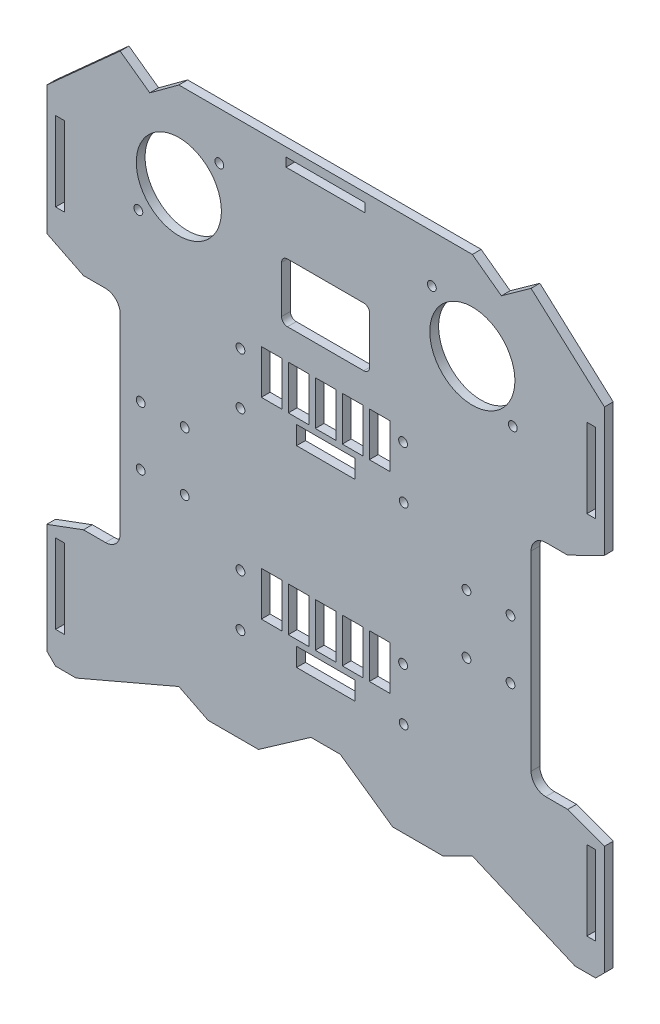
from build123d import *

# Parameters (mm, degrees)
MODEL_R             = 1.5
MODEL_R_2           = 14.5
MODEL_W             = 3
MODEL_H             = 27
MODEL_W_2           = 27
MODEL_H_2           = 3
MODEL_W_3           = 7
MODEL_H_3           = 15
MODEL_W_4           = 19.975
MODEL_H_4           = 6.25
BOSS_EXTRUDE1_DEPTH = 3


with BuildPart() as part:
    # Model → Boss-Extrude1 (new body)
    with BuildSketch(Plane.XY):
        with BuildLine():
            Line((190, 103.697579254), (190, 147.5))
            Line((190, 147.5), (165, 170))
            Line((165, 170), (154.89207995, 162.725031973))
            Line((154.89207995, 162.725031973), (145, 170))
            Line((145, 170), (45, 170))
            Line((45, 170), (35.10792005, 162.725031973))
            Line((35.10792005, 162.725031973), (25, 170))
            Line((25, 170), (0, 147.5))
            Line((0, 147.5), (0, 103.697579254))
            Line((0, 103.697579254), (12.5, 97.5))
            Line((12.5, 97.5), (20, 97.5))
            ThreePointArc((20, 97.5), (23.535533906, 96.035533906), (25, 92.5))
            Line((25, 92.5), (25, 27.5))
            ThreePointArc((25, 27.5), (23.535533906, 23.964466094), (20, 22.5))
            Line((20, 22.5), (12.5, 22.5))
            Line((12.5, 22.5), (0, 17.867533831))
            Line((0, 17.867533831), (0, 0))
            Line((0, 0), (0, -19.5))
            Line((0, -19.5), (3, -22.5))
            Line((3, -22.5), (10, -22.5))
            Line((10, -22.5), (45, -7.5))
            Line((45, -7.5), (55, -12.5))
            Line((55, -12.5), (72.142857143, -12.5))
            Line((72.142857143, -12.5), (90, 0))
            Line((90, 0), (100, 0))
            Line((100, 0), (117.857142857, -12.5))
            Line((117.857142857, -12.5), (135, -12.5))
            Line((135, -12.5), (145, -7.5))
            Line((145, -7.5), (180, -22.5))
            Line((180, -22.5), (187, -22.5))
            Line((187, -22.5), (190, -19.5))
            Line((190, -19.5), (190, 0))
            Line((190, 0), (190, 17.867533831))
            Line((190, 17.867533831), (177.5, 22.5))
            Line((177.5, 22.5), (170, 22.5))
            ThreePointArc((170, 22.5), (166.464466094, 23.964466094), (165, 27.5))
            Line((165, 27.5), (165, 92.5))
            ThreePointArc((165, 92.5), (166.464466094, 96.035533906), (170, 97.5))
            Line((170, 97.5), (177.5, 97.5))
            Line((177.5, 97.5), (190, 103.697579254))
        make_face()
        with Locations((32, 50)):
            Circle(MODEL_R, mode=Mode.SUBTRACT)
        with Locations((47, 50)):
            Circle(MODEL_R, mode=Mode.SUBTRACT)
        with Locations((32, 70)):
            Circle(MODEL_R, mode=Mode.SUBTRACT)
        with Locations((47, 70)):
            Circle(MODEL_R, mode=Mode.SUBTRACT)
        with Locations((158, 70)):
            Circle(MODEL_R, mode=Mode.SUBTRACT)
        with Locations((143, 70)):
            Circle(MODEL_R, mode=Mode.SUBTRACT)
        with Locations((158, 50)):
            Circle(MODEL_R, mode=Mode.SUBTRACT)
        with Locations((143, 50)):
            Circle(MODEL_R, mode=Mode.SUBTRACT)
        with Locations((45, 140)):
            Circle(MODEL_R_2, mode=Mode.SUBTRACT)
        with Locations((31.211417767, 126.211417767)):
            Circle(MODEL_R, mode=Mode.SUBTRACT)
        with Locations((58.788582233, 153.788582233)):
            Circle(MODEL_R, mode=Mode.SUBTRACT)
        with Locations((145, 140)):
            Circle(MODEL_R_2, mode=Mode.SUBTRACT)
        with Locations((158.788582233, 126.211417767)):
            Circle(MODEL_R, mode=Mode.SUBTRACT)
        with Locations((131.211417767, 153.788582233)):
            Circle(MODEL_R, mode=Mode.SUBTRACT)
        with Locations((65.995999264, 37.286813453)):
            Circle(MODEL_R, mode=Mode.SUBTRACT)
        with Locations((65.995999264, 19.661813453)):
            Circle(MODEL_R, mode=Mode.SUBTRACT)
        with Locations((121.395999264, 37.386813453)):
            Circle(MODEL_R, mode=Mode.SUBTRACT)
        with Locations((121.595999264, 19.661813453)):
            Circle(MODEL_R, mode=Mode.SUBTRACT)
        with Locations((65.995999264, 85.107027522)):
            Circle(MODEL_R, mode=Mode.SUBTRACT)
        with Locations((65.995999264, 102.732027522)):
            Circle(MODEL_R, mode=Mode.SUBTRACT)
        with Locations((121.395999264, 102.832027522)):
            Circle(MODEL_R, mode=Mode.SUBTRACT)
        with Locations((121.595999264, 85.107027522)):
            Circle(MODEL_R, mode=Mode.SUBTRACT)
        with Locations((4.5, 126.5)):
            Rectangle(MODEL_W, MODEL_H, mode=Mode.SUBTRACT)
        with Locations((185.5, 126.5)):
            Rectangle(MODEL_W, MODEL_H, mode=Mode.SUBTRACT)
        with Locations((95, 165.5)):
            Rectangle(MODEL_W_2, MODEL_H_2, mode=Mode.SUBTRACT)
        with Locations((76.6, 99.390878679)):
            Rectangle(MODEL_W_3, MODEL_H_3, mode=Mode.SUBTRACT)
        with Locations((85.8, 99.390878679)):
            Rectangle(MODEL_W_3, MODEL_H_3, mode=Mode.SUBTRACT)
        with Locations((95, 99.390878679)):
            Rectangle(MODEL_W_3, MODEL_H_3, mode=Mode.SUBTRACT)
        with Locations((104.2, 99.390878679)):
            Rectangle(MODEL_W_3, MODEL_H_3, mode=Mode.SUBTRACT)
        with Locations((113.4, 99.390878679)):
            Rectangle(MODEL_W_3, MODEL_H_3, mode=Mode.SUBTRACT)
        with Locations((95.108499264, 86.757027522)):
            Rectangle(MODEL_W_4, MODEL_H_4, mode=Mode.SUBTRACT)
        with Locations((76.6, 33.94566461)):
            Rectangle(MODEL_W_3, MODEL_H_3, mode=Mode.SUBTRACT)
        with Locations((85.8, 33.94566461)):
            Rectangle(MODEL_W_3, MODEL_H_3, mode=Mode.SUBTRACT)
        with Locations((95, 33.94566461)):
            Rectangle(MODEL_W_3, MODEL_H_3, mode=Mode.SUBTRACT)
        with Locations((104.2, 33.94566461)):
            Rectangle(MODEL_W_3, MODEL_H_3, mode=Mode.SUBTRACT)
        with Locations((113.4, 33.94566461)):
            Rectangle(MODEL_W_3, MODEL_H_3, mode=Mode.SUBTRACT)
        with Locations((95.108499264, 21.311813453)):
            Rectangle(MODEL_W_4, MODEL_H_4, mode=Mode.SUBTRACT)
        with BuildLine():
            Line((80, 119.172827764), (80, 135.172827764))
            ThreePointArc((80, 135.172827764), (80.585786438, 136.587041326), (82, 137.172827764))
            Line((82, 137.172827764), (108, 137.172827764))
            ThreePointArc((108, 137.172827764), (109.414213562, 136.587041326), (110, 135.172827764))
            Line((110, 135.172827764), (110, 119.172827764))
            ThreePointArc((110, 119.172827764), (109.414213562, 117.758614202), (108, 117.172827764))
            Line((108, 117.172827764), (82, 117.172827764))
            ThreePointArc((82, 117.172827764), (80.585786438, 117.758614202), (80, 119.172827764))
        make_face(mode=Mode.SUBTRACT)
        with Locations((4.5, 1.875)):
            Rectangle(MODEL_W, MODEL_H, mode=Mode.SUBTRACT)
        with Locations((185.5, 1.875)):
            Rectangle(MODEL_W, MODEL_H, mode=Mode.SUBTRACT)
    extrude(amount=BOSS_EXTRUDE1_DEPTH)


solid = part.part
